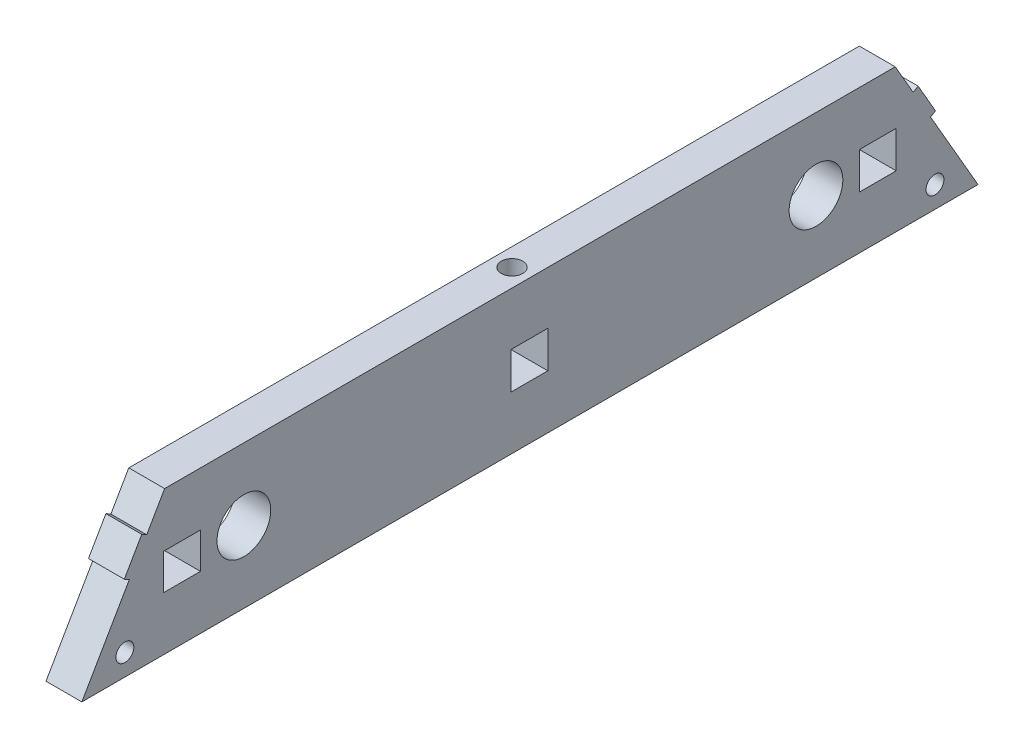
from build123d import *

# Parameters (mm, degrees)
SKETCH1_R                 = 4.7625
SKETCH1_W                 = 6.5278
SKETCH1_H                 = 6.5278
SKETCH1_H_2               = 6.348837221
BOSS_EXTRUDE1_DEPTH       = 6.35
F_6_CLEARANCE_HOLE1_D     = 3.7973
F_6_CLEARANCE_HOLE1_DEPTH = 12.7
F_6_CLEARANCE_HOLE1_TIP   = 1.140824014
SKETCH7_W                 = 6.35
SKETCH7_H                 = 6.1722
BOSS_EXTRUDE2_DEPTH       = 1.016
SKETCH8_W                 = 6.35
SKETCH8_H                 = 6.1722
BOSS_EXTRUDE3_DEPTH       = 1.016
SKETCH9_R                 = 1.5875
CUT_EXTRUDE1_DEPTH        = 161.894515133


with BuildPart() as part:
    # Sketch1 → Boss-Extrude1 (new body)
    with BuildSketch(Plane(origin=(0, 0, 0), x_dir=(0, 0, -1), z_dir=(1, 0, 0))):
        Polygon((0, 0), (-14.664696837, 25.4), (-144.085303163, 25.4), (-158.75, 0), align=None)
        with Locations((-130.048, 12.7)):
            Circle(SKETCH1_R, mode=Mode.SUBTRACT)
        with Locations((-28.702, 12.7)):
            Circle(SKETCH1_R, mode=Mode.SUBTRACT)
        with Locations((-17.750796837, 12.6111)):
            Rectangle(SKETCH1_W, SKETCH1_H, mode=Mode.SUBTRACT)
        with Locations((-140.999203163, 12.70058139)):
            Rectangle(SKETCH1_W, SKETCH1_H_2, mode=Mode.SUBTRACT)
        with Locations((-79.4639, 12.7889)):
            Rectangle(SKETCH1_W, SKETCH1_H, mode=Mode.SUBTRACT)
    extrude(amount=BOSS_EXTRUDE1_DEPTH)

    # #6 Clearance Hole1
    with Locations(Plane(origin=(0, 25.4, 0), x_dir=(1, 0, 0), z_dir=(0, 1, 0))):
        with Locations((3.175, -79.375)):
            Hole(F_6_CLEARANCE_HOLE1_D / 2, depth=F_6_CLEARANCE_HOLE1_DEPTH)
            with Locations((0, 0, -(F_6_CLEARANCE_HOLE1_DEPTH + F_6_CLEARANCE_HOLE1_TIP / 2))):  # 118° drill point
                Cone(0, F_6_CLEARANCE_HOLE1_D / 2, F_6_CLEARANCE_HOLE1_TIP, mode=Mode.SUBTRACT)

    # Sketch7 → Boss-Extrude2 (add)
    with BuildSketch(Plane(origin=(0, 0, 0), x_dir=(-1, 0, 0), z_dir=(0, 0.499999999999998, -0.8660254037844397))):
        with Locations((-3.175, 19.893293675)):
            Rectangle(SKETCH7_W, SKETCH7_H)
    extrude(amount=BOSS_EXTRUDE2_DEPTH)

    # Sketch8 → Boss-Extrude3 (add)
    with BuildSketch(Plane(origin=(0, 68.740766425, 119.0625), x_dir=(1, 0, 0), z_dir=(0, 0.500000000000004, 0.8660254037844365))):
        with Locations((3.175, -59.481706325)):
            Rectangle(SKETCH8_W, SKETCH8_H)
    extrude(amount=BOSS_EXTRUDE3_DEPTH)

    # Sketch9 → Cut-Extrude1 (cut, through all)
    with BuildSketch(Plane(origin=(6.35, 0, 0), x_dir=(0, 0, -1), z_dir=(1, 0, 0))):
        with Locations((-151.13, 3.81)):
            Circle(SKETCH9_R)
        with Locations((-7.62, 3.81)):
            Circle(SKETCH9_R)
    extrude(amount=-CUT_EXTRUDE1_DEPTH, mode=Mode.SUBTRACT)


solid = part.part
